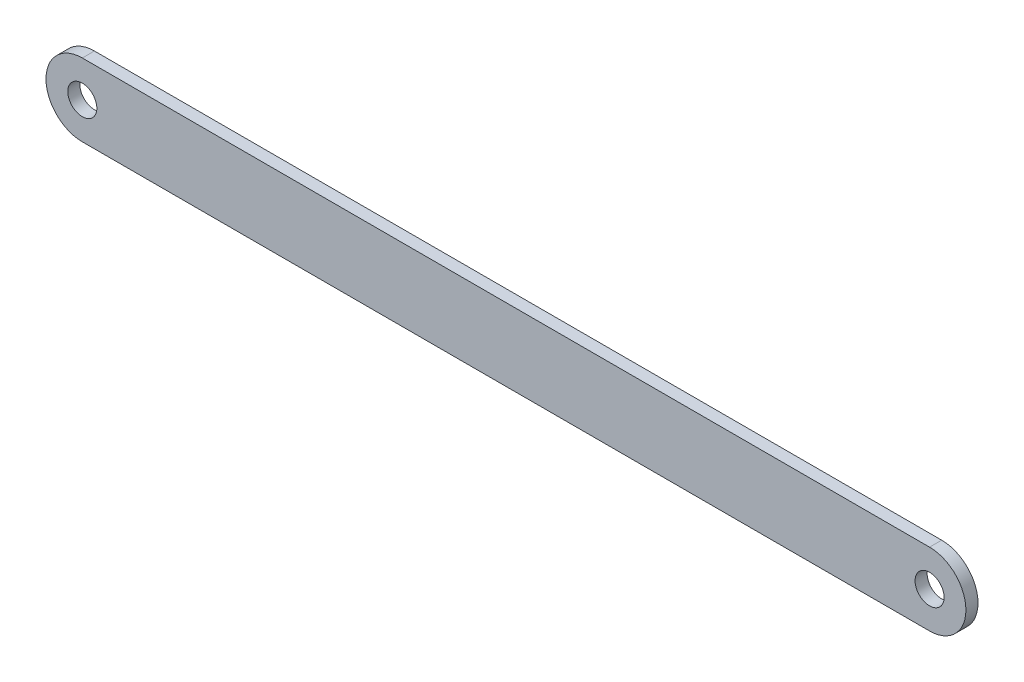
from build123d import *

# Parameters (mm, degrees)
SKETCH1_R           = 6
BOSS_EXTRUDE1_DEPTH = 5


with BuildPart() as part:
    # Sketch1 → Boss-Extrude1 (new body)
    with BuildSketch(Plane.XY):
        with BuildLine():
            Line((0, 15), (350, 15))
            ThreePointArc((350, 15), (365, 0), (350, -15))
            Line((350, -15), (0, -15))
            ThreePointArc((0, -15), (-15, 0), (0, 15))
        make_face()
        Circle(SKETCH1_R, mode=Mode.SUBTRACT)
        with Locations((350, 0)):
            Circle(SKETCH1_R, mode=Mode.SUBTRACT)
    extrude(amount=BOSS_EXTRUDE1_DEPTH)


solid = part.part
